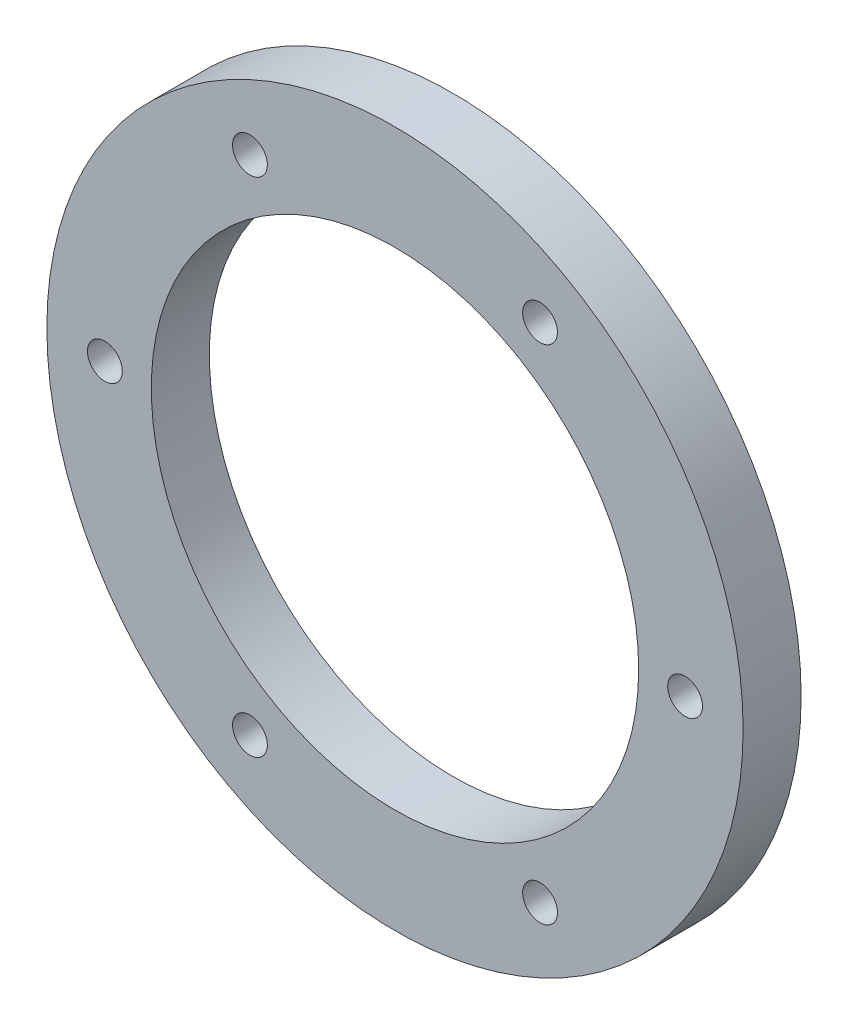
from build123d import *

# Parameters (mm, degrees)
SKETCH1_R           = 30
SKETCH1_R_2         = 21
SKETCH1_R_3         = 1.5
BOSS_EXTRUDE1_DEPTH = 5


with BuildPart() as part:
    # Sketch1 → Boss-Extrude1 (new body)
    with BuildSketch(Plane.XY):
        Circle(SKETCH1_R)
        Circle(SKETCH1_R_2, mode=Mode.SUBTRACT)
        with Locations((-12.5, 21.650635095)):
            Circle(SKETCH1_R_3, mode=Mode.SUBTRACT)
        with Locations((-25, 0)):
            Circle(SKETCH1_R_3, mode=Mode.SUBTRACT)
        with Locations((-12.5, -21.650635095)):
            Circle(SKETCH1_R_3, mode=Mode.SUBTRACT)
        with Locations((12.5, -21.650635095)):
            Circle(SKETCH1_R_3, mode=Mode.SUBTRACT)
        with Locations((25, 0)):
            Circle(SKETCH1_R_3, mode=Mode.SUBTRACT)
        with Locations((12.5, 21.650635095)):
            Circle(SKETCH1_R_3, mode=Mode.SUBTRACT)
    extrude(amount=BOSS_EXTRUDE1_DEPTH)


solid = part.part
